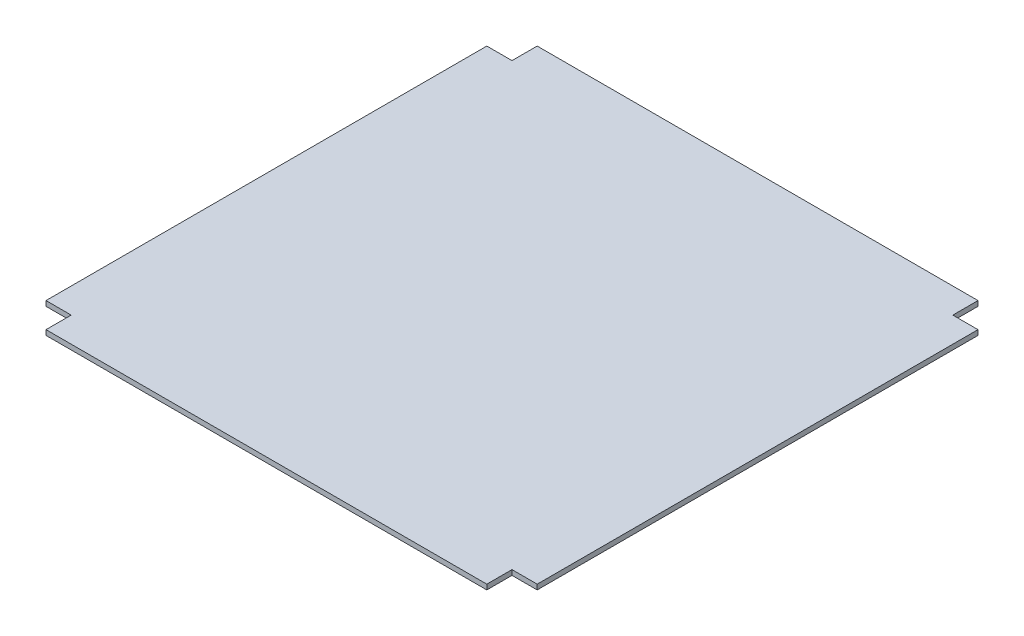
from build123d import *

# Parameters (mm, degrees)
SKETCH1_W           = 390
SKETCH1_H           = 390
BOSS_EXTRUDE1_DEPTH = 4
SKETCH2_W           = 20
SKETCH2_H           = 20
CUT_EXTRUDE1_DEPTH  = 10


with BuildPart() as part:
    # Sketch1 → Boss-Extrude1 (new body)
    with BuildSketch(Plane(origin=(0, 0, 0), x_dir=(1, 0, 0), z_dir=(0, 1, 0))):
        Rectangle(SKETCH1_W, SKETCH1_H)
    extrude(amount=BOSS_EXTRUDE1_DEPTH)

    # Sketch2 → Cut-Extrude1 (cut)
    with BuildSketch(Plane(origin=(0, 4, 0), x_dir=(1, 0, 0), z_dir=(0, 1, 0))):
        with Locations((-185, 185)):
            Rectangle(SKETCH2_W, SKETCH2_H)
        with Locations((185, 185)):
            Rectangle(SKETCH2_W, SKETCH2_H)
        with Locations((185, -185)):
            Rectangle(SKETCH2_W, SKETCH2_H)
        with Locations((-185, -185)):
            Rectangle(SKETCH2_W, SKETCH2_H)
    extrude(amount=-CUT_EXTRUDE1_DEPTH, mode=Mode.SUBTRACT)


solid = part.part
